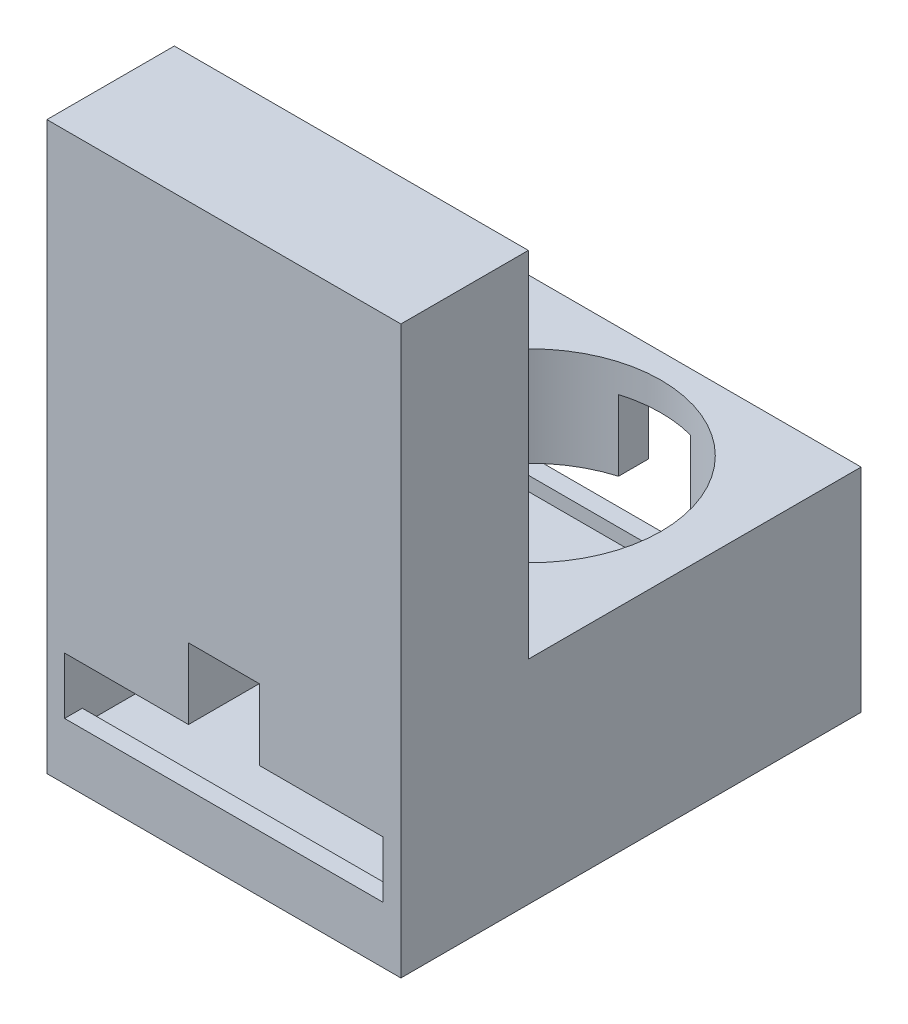
from build123d import *

# Parameters (mm, degrees)
SKETCH1_W           = 50
SKETCH1_H           = 65
BOSS_EXTRUDE1_DEPTH = 30
SKETCH3_W           = 10
SKETCH3_H           = 10
SKETCH3_W_2         = 45
SKETCH3_H_2         = 8
CUT_EXTRUDE4_DEPTH  = 88.321245983
SKETCH4_W           = 60
SKETCH4_H           = 2
CUT_EXTRUDE5_DEPTH  = 45
CUT_EXTRUDE6_REACH  = 89.321
SKETCH5_R           = 18.5
SKETCH6_W           = 50
SKETCH6_H           = 18
BOSS_EXTRUDE2_DEPTH = 50


with BuildPart() as part:
    # Sketch1 → Boss-Extrude1 (new body)
    with BuildSketch(Plane(origin=(0, 0, 0), x_dir=(1, 0, 0), z_dir=(0, 1, 0))):
        with Locations((25, 32.5)):
            Rectangle(SKETCH1_W, SKETCH1_H)
    extrude(amount=BOSS_EXTRUDE1_DEPTH)

    # Sketch3 → Cut-Extrude4 (cut, through all)
    with BuildSketch(Plane.XY):
        with Locations((25, 21)):
            Rectangle(SKETCH3_W, SKETCH3_H)
        with Locations((25, 12)):
            Rectangle(SKETCH3_W_2, SKETCH3_H_2)
    extrude(amount=-CUT_EXTRUDE4_DEPTH, mode=Mode.SUBTRACT)

    # Sketch4 → Cut-Extrude5 (cut)
    with BuildSketch(Plane.ZY.offset(-47.5)):
        with Locations((-32.5, 7)):
            Rectangle(SKETCH4_W, SKETCH4_H)
    extrude(amount=CUT_EXTRUDE5_DEPTH, mode=Mode.SUBTRACT)

    # Cut-Extrude6: up to this face of the body (flat: up to its plane)
    cut_extrude6_end = Plane(part.part.faces().sort_by_distance((11.25, 16, -32.5))[0])
    # Sketch5 → Cut-Extrude6 (cut, up to the picked face)
    with BuildSketch(Plane(origin=(0, 30, 0), x_dir=(1, 0, 0), z_dir=(0, 1, 0)), mode=Mode.PRIVATE) as cut_extrude6_sk1:
        with Locations(Location((25.244510865, 43, 0), (0, 0, 270))):
            Circle(SKETCH5_R)
    cut_extrude6_tool1 = split(extrude(cut_extrude6_sk1.sketch, amount=-CUT_EXTRUDE6_REACH, mode=Mode.PRIVATE), bisect_by=cut_extrude6_end, keep=Keep.BOTH, mode=Mode.PRIVATE)
    add(cut_extrude6_tool1.solids().sort_by(Axis((25.244511, 30, -43), (0, -1, 0)))[0], mode=Mode.SUBTRACT)

    # Sketch6 → Boss-Extrude2 (add)
    with BuildSketch(Plane(origin=(0, 30, 0), x_dir=(1, 0, 0), z_dir=(0, 1, 0))):
        with Locations((25, 9)):
            Rectangle(SKETCH6_W, SKETCH6_H)
    extrude(amount=BOSS_EXTRUDE2_DEPTH)


solid = part.part
